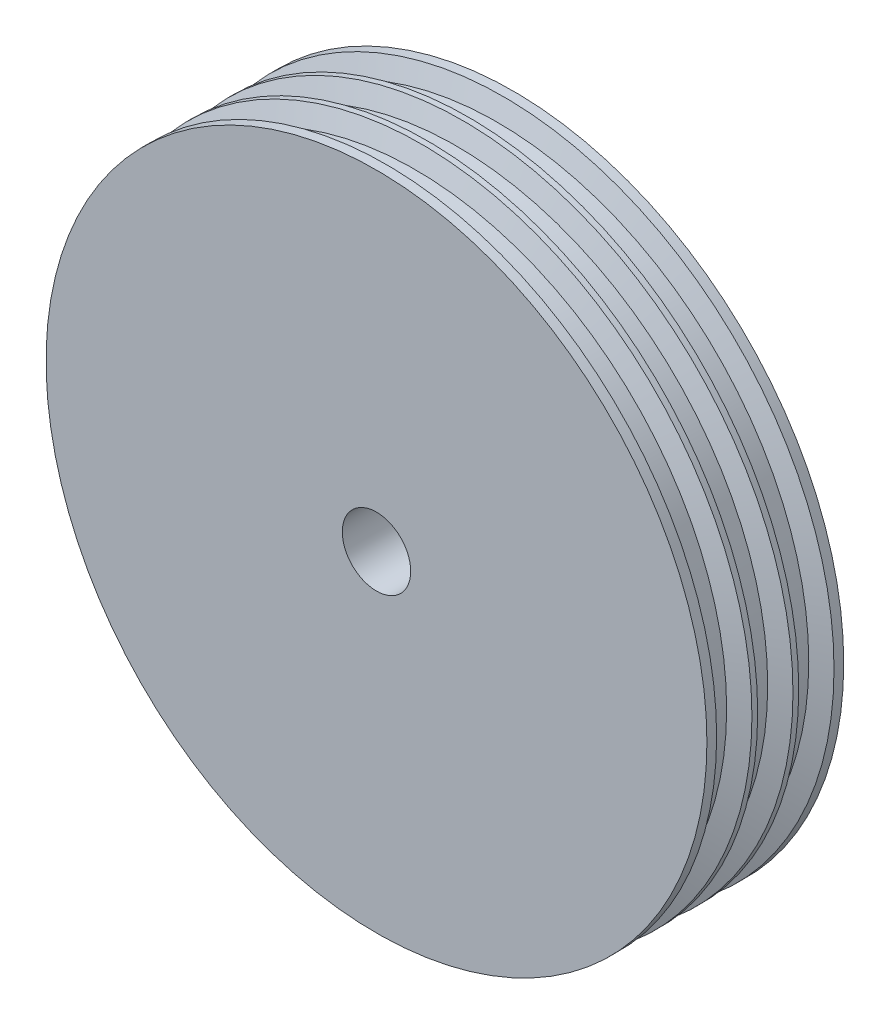
from build123d import *


with BuildPart() as part:
    # 草图2 → 旋转1 (revolve)
    with BuildSketch(Plane(origin=(0, 0, 0), x_dir=(0, 0, -1), z_dir=(1, 0, 0)), mode=Mode.PRIVATE) as revolve_1_sk:
        Polygon((0, 12.5), (50, 12.5), (50, 120.75), (46.446900937, 120.75), (44.081734967, 113.881059263), (35.918265033, 113.881059263), (33.553099063, 120.75), (31.446900937, 120.75), (29.081734967, 113.881059263), (20.918265033, 113.881059263), (18.553099063, 120.75), (16.446900937, 120.75), (14.081734967, 113.881059263), (5.918265033, 113.881059263), (3.553099063, 120.75), (0, 120.75), align=None)
    revolve(revolve_1_sk.sketch.rotate(Axis((0, 0, 0), (0, 0, -1)), 90), axis=Axis((0, 0, 0), (0, 0, -1)))


solid = part.part
